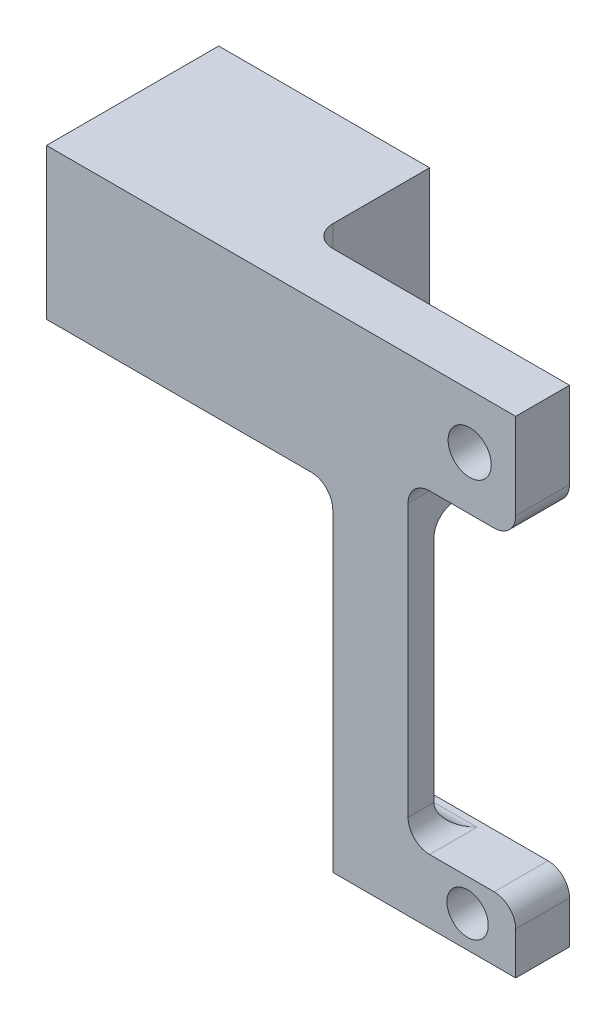
from build123d import *

# Parameters (mm, degrees)
SKETCH1_W            = 24.892
SKETCH1_H            = 17.78
BOSS_EXTRUDE1_DEPTH  = 20.32
SKETCH2_W            = 6.35
SKETCH2_H            = 17.78
BOSS_EXTRUDE2_DEPTH  = 17.78
SKETCH16_W           = 6.35
SKETCH16_H           = 12.7
BOSS_EXTRUDE11_DEPTH = 12.7
SKETCH20_W           = 8.89
SKETCH20_H           = 3.048
BOSS_EXTRUDE12_DEPTH = 39.624
SKETCH21_W           = 8.89
SKETCH21_H           = 7.539530378
BOSS_EXTRUDE13_DEPTH = 3.302
SKETCH22_W           = 6.35
SKETCH22_H           = 7.539530378
BOSS_EXTRUDE14_DEPTH = 12.7
SKETCH18_R           = 2.547686281
SKETCH18_R_2         = 2.439237793
CUT_EXTRUDE11_DEPTH  = 72.056471626
FILLET8_R            = 2.54


with BuildPart() as part:
    # Sketch1 → Boss-Extrude1 (new body)
    with BuildSketch(Plane.XY):
        with Locations((12.446, 8.89)):
            Rectangle(SKETCH1_W, SKETCH1_H)
    extrude(amount=BOSS_EXTRUDE1_DEPTH)

    # Sketch2 → Boss-Extrude2 (add)
    with BuildSketch(Plane(origin=(24.892, 0, 0), x_dir=(0, 0, -1), z_dir=(1, 0, 0))):
        with Locations((-17.145, 8.89)):
            Rectangle(SKETCH2_W, SKETCH2_H)
    extrude(amount=BOSS_EXTRUDE2_DEPTH)

    # Sketch16 → Boss-Extrude11 (add)
    with BuildSketch(Plane(origin=(42.672, 0, 0), x_dir=(0, 0, -1), z_dir=(1, 0, 0))):
        with Locations((-17.145, 11.43)):
            Rectangle(SKETCH16_W, SKETCH16_H)
    extrude(amount=BOSS_EXTRUDE11_DEPTH)

    # Sketch20 → Boss-Extrude12 (add)
    with BuildSketch(Plane.XZ):
        with Locations((38.227, 18.796)):
            Rectangle(SKETCH20_W, SKETCH20_H)
    extrude(amount=BOSS_EXTRUDE12_DEPTH)

    # Sketch21 → Boss-Extrude13 (add)
    with BuildSketch(Plane(origin=(0, 0, 17.272), x_dir=(-1, 0, 0), z_dir=(0, 0, -1))):
        with Locations((-38.227, -35.854234811)):
            Rectangle(SKETCH21_W, SKETCH21_H)
    extrude(amount=BOSS_EXTRUDE13_DEPTH)

    # Sketch22 → Boss-Extrude14 (add)
    with BuildSketch(Plane(origin=(42.672, 0, 0), x_dir=(0, 0, -1), z_dir=(1, 0, 0))):
        with Locations((-17.145, -35.854234811)):
            Rectangle(SKETCH22_W, SKETCH22_H)
    extrude(amount=BOSS_EXTRUDE14_DEPTH)

    # Sketch18 → Cut-Extrude11 (cut, through all)
    with BuildSketch(Plane.XY.offset(20.32)):
        with Locations((49.940213472, 11.366437705)):
            Circle(SKETCH18_R)
        with Locations((49.693177742, -35.877562295)):
            Circle(SKETCH18_R_2)
    extrude(amount=-CUT_EXTRUDE11_DEPTH, mode=Mode.SUBTRACT)

    # Fillet8
    fillet8_edges = [part.edges().sort_by_distance(p)[0] for p in [
        (24.892, 8.89, 13.97),
        (42.672, 5.08, 17.145),
        (55.372, 5.08, 17.145),
        (33.782, 0, 18.796),
        (38.227, 0, 17.272),
        (33.782, -16.042234811, 17.272),
        (38.227, -32.084469622, 17.272),
        (33.782, -32.084469622, 15.621),
        (42.672, -32.084469622, 18.796),
        (55.372, -32.084469622, 17.145),
    ]]
    fillet(fillet8_edges, radius=FILLET8_R)


solid = part.part
